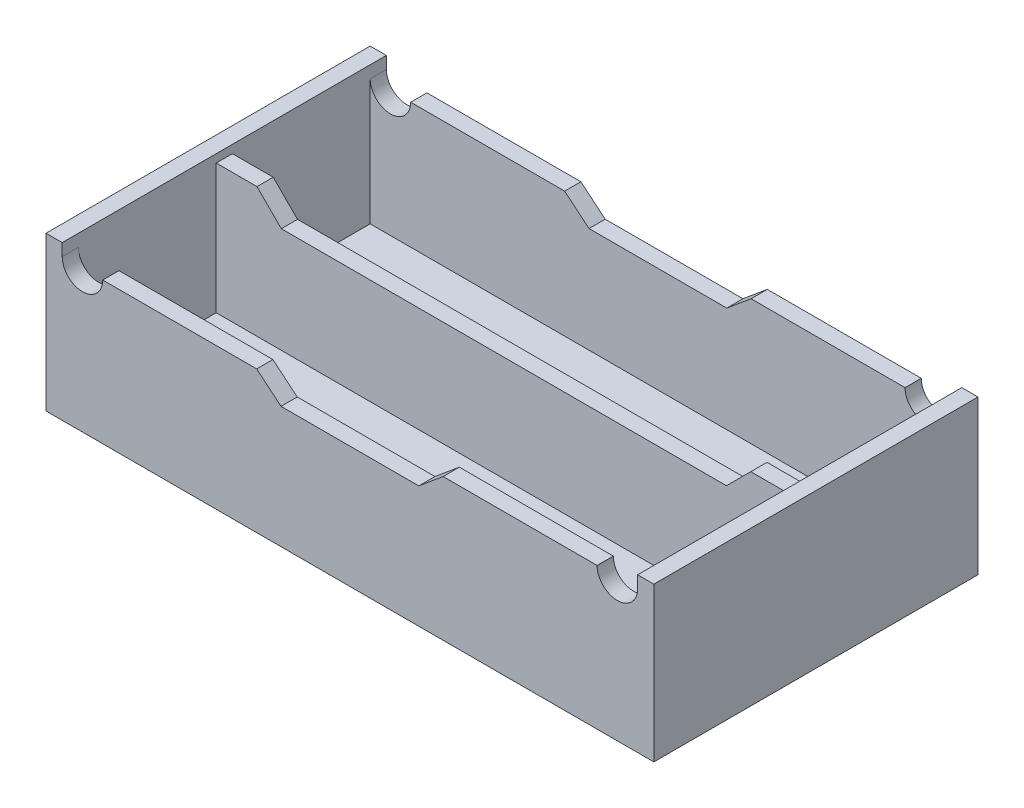
from build123d import *

# Parameters (mm, degrees)
SKETCH1_W           = 75
SKETCH1_H           = 40
BOSS_EXTRUDE1_DEPTH = 2
SKETCH2_W           = 75
SKETCH2_H           = 40
SKETCH2_W_2         = 71
SKETCH2_H_2         = 17
BOSS_EXTRUDE2_DEPTH = 17
CUT_EXTRUDE2_DEPTH  = 17
CUT_EXTRUDE3_REACH  = 82.169
CUT_EXTRUDE4_REACH  = 88.683
SKETCH5_R           = 1.6


with BuildPart() as part:
    # Sketch1 → Boss-Extrude1 (new body)
    with BuildSketch(Plane(origin=(0, 0, 0), x_dir=(1, 0, 0), z_dir=(0, 1, 0))):
        with Locations((37.5, 20)):
            Rectangle(SKETCH1_W, SKETCH1_H)
    extrude(amount=BOSS_EXTRUDE1_DEPTH)

    # Sketch2 → Boss-Extrude2 (add)
    with BuildSketch(Plane(origin=(0, 2, 0), x_dir=(1, 0, 0), z_dir=(0, 1, 0))):
        with Locations((37.5, 20)):
            Rectangle(SKETCH2_W, SKETCH2_H)
        with Locations((37.5, 29.5)):
            Rectangle(SKETCH2_W_2, SKETCH2_H_2, mode=Mode.SUBTRACT)
        with Locations((37.5, 10.5)):
            Rectangle(SKETCH2_W_2, SKETCH2_H_2, mode=Mode.SUBTRACT)
    extrude(amount=BOSS_EXTRUDE2_DEPTH)

    # Sketch3 → Cut-Extrude2 (cut)
    with BuildSketch(Plane.XY):
        with BuildLine():
            Line((2, 17.5), (2, 19))
            Line((2, 19), (73, 19))
            Line((73, 19), (73, 17.5))
            ThreePointArc((73, 17.5), (70.5, 15), (68, 17.5))
            Line((68, 17.5), (49, 17.5))
            Line((49, 17.5), (46, 15))
            Line((46, 15), (29, 15))
            Line((29, 15), (26, 17.5))
            Line((26, 17.5), (7, 17.5))
            ThreePointArc((7, 17.5), (4.5, 15), (2, 17.5))
        make_face()
    cut_extrude2 = extrude(amount=-CUT_EXTRUDE2_DEPTH, mode=Mode.SUBTRACT)

    # Mirror1: Cut-Extrude2 across plane
    add(cut_extrude2.mirror(Plane.XY.offset(-20)), mode=Mode.SUBTRACT)

    # Sketch4 → Cut-Extrude3 (cut, up to next)
    with BuildSketch(Plane.XY.offset(-19), mode=Mode.PRIVATE) as cut_extrude3_sk1:
        Polygon((2, 18), (7.035918341, 18), (10.035918341, 15), (64.964081659, 15), (67.964081659, 18), (73, 18), (73, 19), (2, 19), align=None)
    cut_extrude3_tool1 = extrude(cut_extrude3_sk1.sketch, amount=-CUT_EXTRUDE3_REACH, mode=Mode.PRIVATE) & part.part
    add(cut_extrude3_tool1.solids().sort_by_distance((37.5, 17.098486, -19))[0], mode=Mode.SUBTRACT)

    # Sketch5 → Cut-Extrude4 (cut, up to next)
    with BuildSketch(Plane(origin=(0, 2, 0), x_dir=(1, 0, 0), z_dir=(0, 1, 0)), mode=Mode.PRIVATE) as cut_extrude4_sk1:
        with Locations(Location((37.5, 29.5, 0), (0, 0, 270))):
            Circle(SKETCH5_R)
    cut_extrude4_tool1 = extrude(cut_extrude4_sk1.sketch, amount=-CUT_EXTRUDE4_REACH, mode=Mode.PRIVATE) & part.part
    # Sketch5 → Cut-Extrude4 (cut, up to next)
    with BuildSketch(Plane(origin=(0, 2, 0), x_dir=(1, 0, 0), z_dir=(0, 1, 0)), mode=Mode.PRIVATE) as cut_extrude4_sk2:
        with Locations(Location((37.5, 10.5, 0), (0, 0, 270))):
            Circle(SKETCH5_R)
    cut_extrude4_tool2 = extrude(cut_extrude4_sk2.sketch, amount=-CUT_EXTRUDE4_REACH, mode=Mode.PRIVATE) & part.part
    add(cut_extrude4_tool1.solids().sort_by_distance((37.5, 2, -29.5))[0], mode=Mode.SUBTRACT)
    add(cut_extrude4_tool2.solids().sort_by_distance((37.5, 2, -10.5))[0], mode=Mode.SUBTRACT)


solid = part.part
